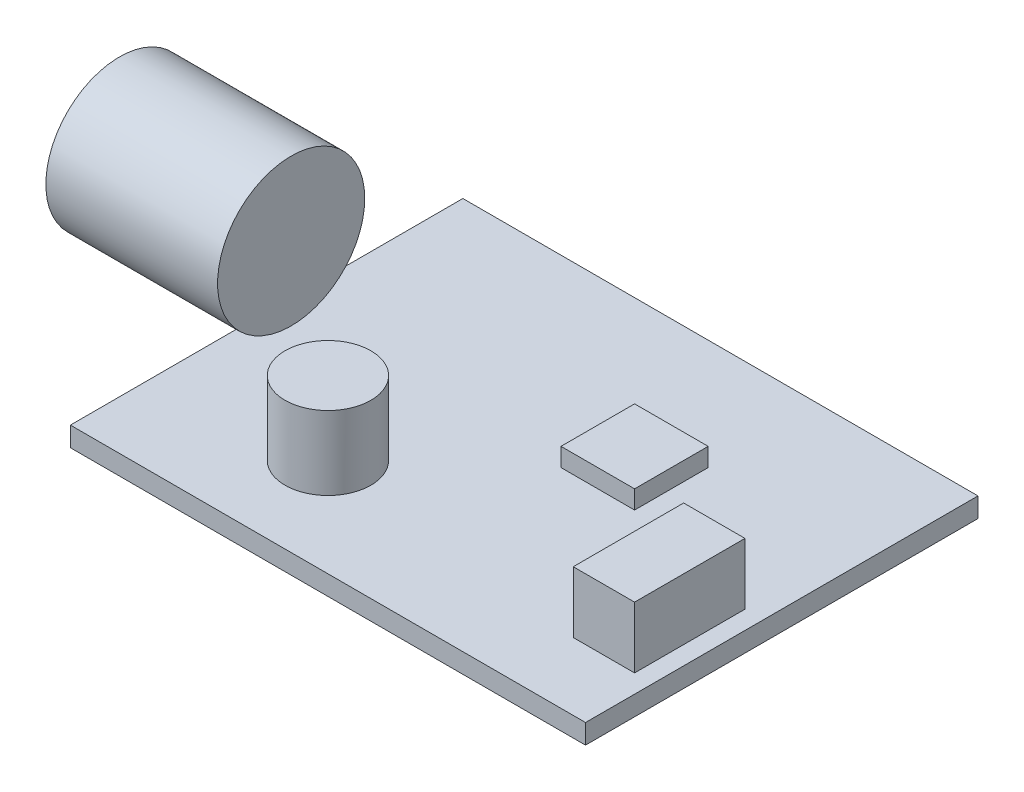
from build123d import *

# Parameters (mm, degrees)
SKETCH1_W           = 42
SKETCH1_H           = 32
PCB_DEPTH           = 1.6
IC_START            = 1.6
SKETCH2_W           = 6
SKETCH2_H           = 6
IC_DEPTH            = 1.5
OUT_CONNECTOR_START = 1.6
SKETCH3_W           = 5
SKETCH3_H           = 9
OUT_CONNECTOR_DEPTH = 5
BNC_SOCKET_START    = -33
SKETCH4_R           = 6
BNC_SOCKET_DEPTH    = 14
TRIM_POT_START      = 1.6
SKETCH5_R           = 3.5
TRIM_POT_DEPTH      = 6


with BuildPart() as part:
    # Sketch1 → PCB (new body)
    with BuildSketch(Plane(origin=(0, 0, 0), x_dir=(1, 0, 0), z_dir=(0, 1, 0))):
        Rectangle(SKETCH1_W, SKETCH1_H)
    extrude(amount=PCB_DEPTH)

    # Sketch2 → IC (add)
    with BuildSketch(Plane(origin=(0, 0, 0), x_dir=(1, 0, 0), z_dir=(0, 1, 0)).offset(IC_START)):
        with Locations((5, 4)):
            Rectangle(SKETCH2_W, SKETCH2_H)
    extrude(amount=IC_DEPTH)

    # Sketch3 → Out_Connector (add)
    with BuildSketch(Plane(origin=(0, 0, 0), x_dir=(1, 0, 0), z_dir=(0, 1, 0)).offset(OUT_CONNECTOR_START)):
        with Locations((17, -6)):
            Rectangle(SKETCH3_W, SKETCH3_H)
    extrude(amount=OUT_CONNECTOR_DEPTH)

    # Sketch5 → Trim_Pot (add)
    with BuildSketch(Plane(origin=(0, 0, 0), x_dir=(1, 0, 0), z_dir=(0, 1, 0)).offset(TRIM_POT_START)):
        with Locations(Location((-8, -8, 0), (0, 0, 90))):
            Circle(SKETCH5_R)
    extrude(amount=TRIM_POT_DEPTH)


with BuildPart() as body_2:
    # Sketch4 → BNC_Socket (new body)
    with BuildSketch(Plane(origin=(0, 0, 0), x_dir=(0, 0, -1), z_dir=(1, 0, 0)).offset(BNC_SOCKET_START)):
        with Locations((0, 7.6)):
            Circle(SKETCH4_R)
    extrude(amount=BNC_SOCKET_DEPTH)


solid = Compound([part.part, body_2.part])
